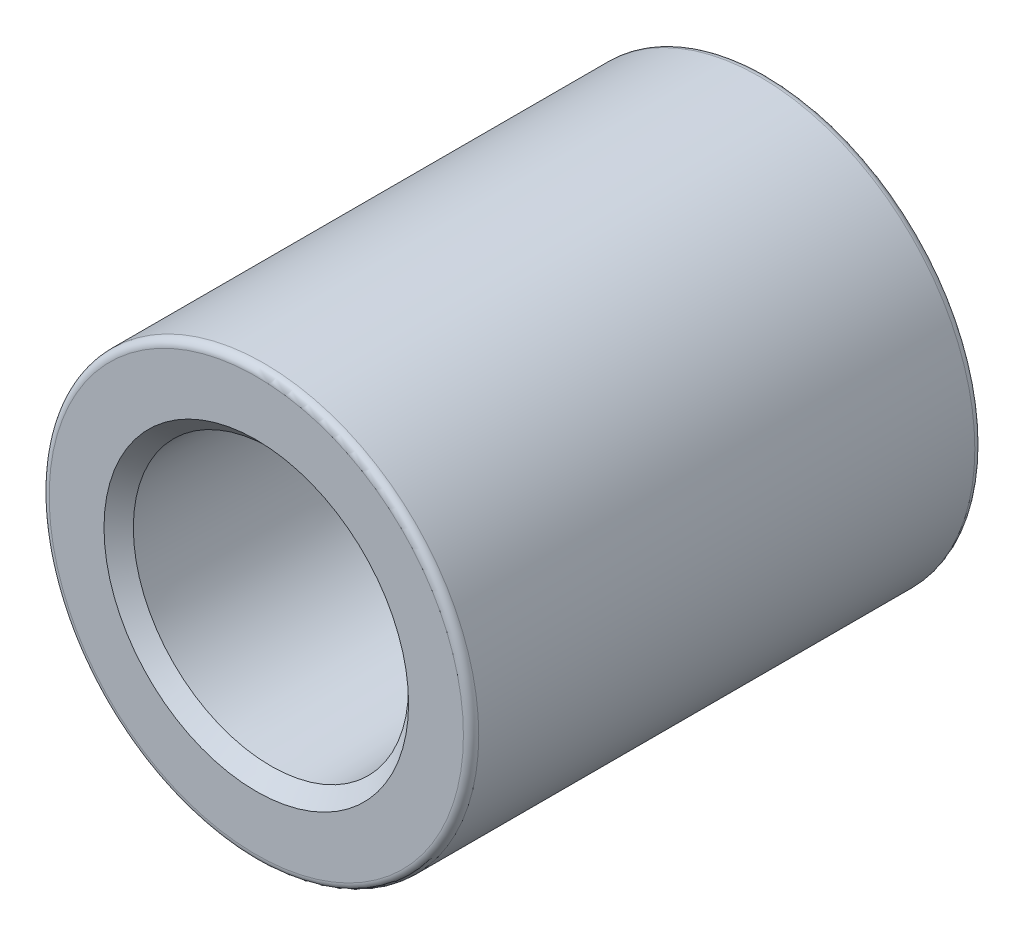
from build123d import *

# Parameters (mm, degrees)
SKETCH1_R                   = 10.668
EXTRUDE1_DEPTH              = 12.7
SKETCH2_R                   = 6.858
CUT_EXTRUDE1_DEPTH          = 10.20572
CUT_EXTRUDE1_DRAFT          = -1.783333333
SKETCH5_R                   = 7.563555556
CUT_EXTRUDE3_DEPTH          = 3.175
CUT_EXTRUDE3_DRAFT          = -45
CIRPATTERN1_COPY_1_SKETCH_R = 6.858
CIRPATTERN1_COPY_1_DEPTH    = 10.20572
CIRPATTERN1_COPY_1_DRAFT    = -1.783333333
CIRPATTERN1_COPY_2_SKETCH_R = 7.563555556
CIRPATTERN1_COPY_2_DEPTH    = 3.175
CIRPATTERN1_COPY_2_DRAFT    = -45
FILLET1_R                   = 0.381


with BuildPart() as part:
    # Sketch1 → Extrude1 (new, symmetric)
    with BuildSketch(Plane.XY):
        Circle(SKETCH1_R)
    extrude(amount=EXTRUDE1_DEPTH, both=True)


with BuildPart() as cut_extrude1_tool:
    # Sketch2 → Cut-Extrude1 (with draft: the straight prism first)
    with BuildSketch(Plane.XY.offset(12.7)):
        Circle(SKETCH2_R)
    extrude(amount=-CUT_EXTRUDE1_DEPTH)
    # Cut-Extrude1: the draft: its side faces are tilted about the plane it starts from
    cut_extrude1_sides = [cut_extrude1_tool.faces().sort_by_distance(p)[0] for p in [
        (-6.858, 0, 7.59714),
    ]]
    draft(cut_extrude1_sides, Plane.XY.offset(12.7), CUT_EXTRUDE1_DRAFT)


with BuildPart() as part_1:
    add(part.part)

    # Cut-Extrude1: cut by cut_extrude1_tool
    add(cut_extrude1_tool.part, mode=Mode.SUBTRACT)


with BuildPart() as cut_extrude3_tool:
    # Sketch5 → Cut-Extrude3 (with draft: the straight prism first)
    with BuildSketch(Plane.XY.offset(12.7)):
        Circle(SKETCH5_R)
    extrude(amount=-CUT_EXTRUDE3_DEPTH)
    # Cut-Extrude3: the draft: its side faces are tilted about the plane it starts from
    cut_extrude3_sides = [cut_extrude3_tool.faces().sort_by_distance(p)[0] for p in [
        (-7.563555556, 0, 11.1125),
    ]]
    draft(cut_extrude3_sides, Plane.XY.offset(12.7), CUT_EXTRUDE3_DRAFT)


with BuildPart() as part_2:
    add(part_1.part)

    # Cut-Extrude3: cut by cut_extrude3_tool
    add(cut_extrude3_tool.part, mode=Mode.SUBTRACT)


with BuildPart() as cirpattern1_copy_1_tool:
    # CirPattern1 copy 1 sketch → CirPattern1 copy 1 (with draft: the straight prism first)
    with BuildSketch(Plane(origin=(0, 0, -12.7), x_dir=(-1, 0, 0), z_dir=(0, 0, -1))):
        Circle(CIRPATTERN1_COPY_1_SKETCH_R)
    extrude(amount=-CIRPATTERN1_COPY_1_DEPTH)
    # CirPattern1 copy 1: the draft: its side faces are tilted about the plane it starts from
    cirpattern1_copy_1_sides = [cirpattern1_copy_1_tool.faces().sort_by_distance(p)[0] for p in [
        (6.858, 0, -7.59714),
    ]]
    draft(cirpattern1_copy_1_sides, Plane(origin=(0, 0, -12.7), x_dir=(-1, 0, 0), z_dir=(0, 0, -1)), CIRPATTERN1_COPY_1_DRAFT)


with BuildPart() as part_3:
    add(part_2.part)

    # CirPattern1 copy 1: cut by cirpattern1_copy_1_tool
    add(cirpattern1_copy_1_tool.part, mode=Mode.SUBTRACT)


with BuildPart() as cirpattern1_copy_2_tool:
    # CirPattern1 copy 2 sketch → CirPattern1 copy 2 (with draft: the straight prism first)
    with BuildSketch(Plane(origin=(0, 0, -12.7), x_dir=(-1, 0, 0), z_dir=(0, 0, -1))):
        Circle(CIRPATTERN1_COPY_2_SKETCH_R)
    extrude(amount=-CIRPATTERN1_COPY_2_DEPTH)
    # CirPattern1 copy 2: the draft: its side faces are tilted about the plane it starts from
    cirpattern1_copy_2_sides = [cirpattern1_copy_2_tool.faces().sort_by_distance(p)[0] for p in [
        (7.563555556, 0, -11.1125),
    ]]
    draft(cirpattern1_copy_2_sides, Plane(origin=(0, 0, -12.7), x_dir=(-1, 0, 0), z_dir=(0, 0, -1)), CIRPATTERN1_COPY_2_DRAFT)


with BuildPart() as part_4:
    add(part_3.part)

    # CirPattern1 copy 2: cut by cirpattern1_copy_2_tool
    add(cirpattern1_copy_2_tool.part, mode=Mode.SUBTRACT)

    # Fillet1
    fillet1_edges = [part_4.edges().sort_by_distance(p)[0] for p in [
        (-10.668, 0, -12.7),
        (-10.668, 0, 12.7),
    ]]
    fillet(fillet1_edges, radius=FILLET1_R)


solid = part_4.part
